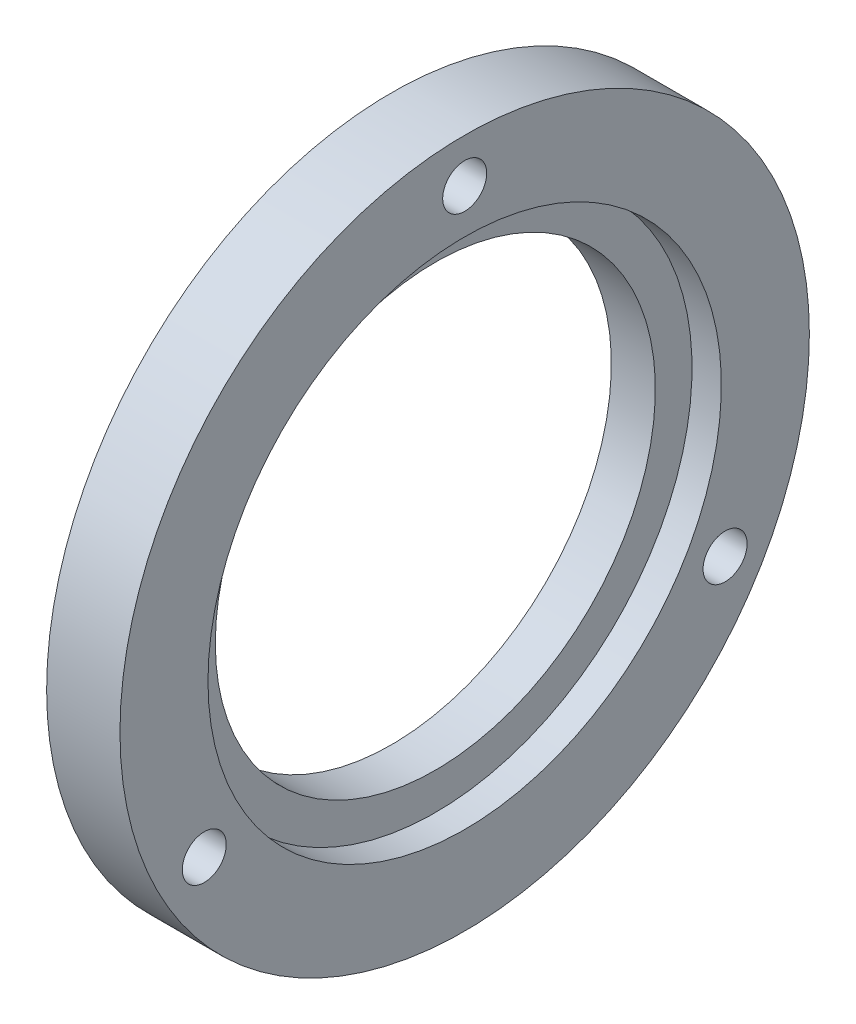
from build123d import *

# Parameters (mm, degrees)
CUT_EXTRUDE1_DEPTH      = 34.608034754
CUT_EXTRUDE1_DEPTH_BACK = 34.608034754
SKETCH2_R               = 1.5


with BuildPart() as part:
    # Sketch1 → Revolve1 (revolve)
    with BuildSketch(Plane.XY, mode=Mode.PRIVATE) as revolve1_sk:
        Polygon((0, 15), (0, 23.5), (5, 23.5), (5, 17.5), (3, 17.5), (3, 15), align=None)
    revolve(revolve1_sk.sketch.rotate(Axis((0, 0, 0), (1, 0, 0)), 90), axis=Axis((0, 0, 0), (1, 0, 0)))

    # Sketch2 → Cut-Extrude1 (cut, two sides: drawn at the far end of the back side and taken through both)
    with BuildSketch(Plane.ZY.offset(-CUT_EXTRUDE1_DEPTH_BACK)):
        with Locations((0, 20.5)):
            Circle(SKETCH2_R)
        with Locations((17.753520778, -10.25)):
            Circle(SKETCH2_R)
        with Locations((-17.753520778, -10.25)):
            Circle(SKETCH2_R)
    extrude(amount=CUT_EXTRUDE1_DEPTH + CUT_EXTRUDE1_DEPTH_BACK, mode=Mode.SUBTRACT)


solid = part.part
